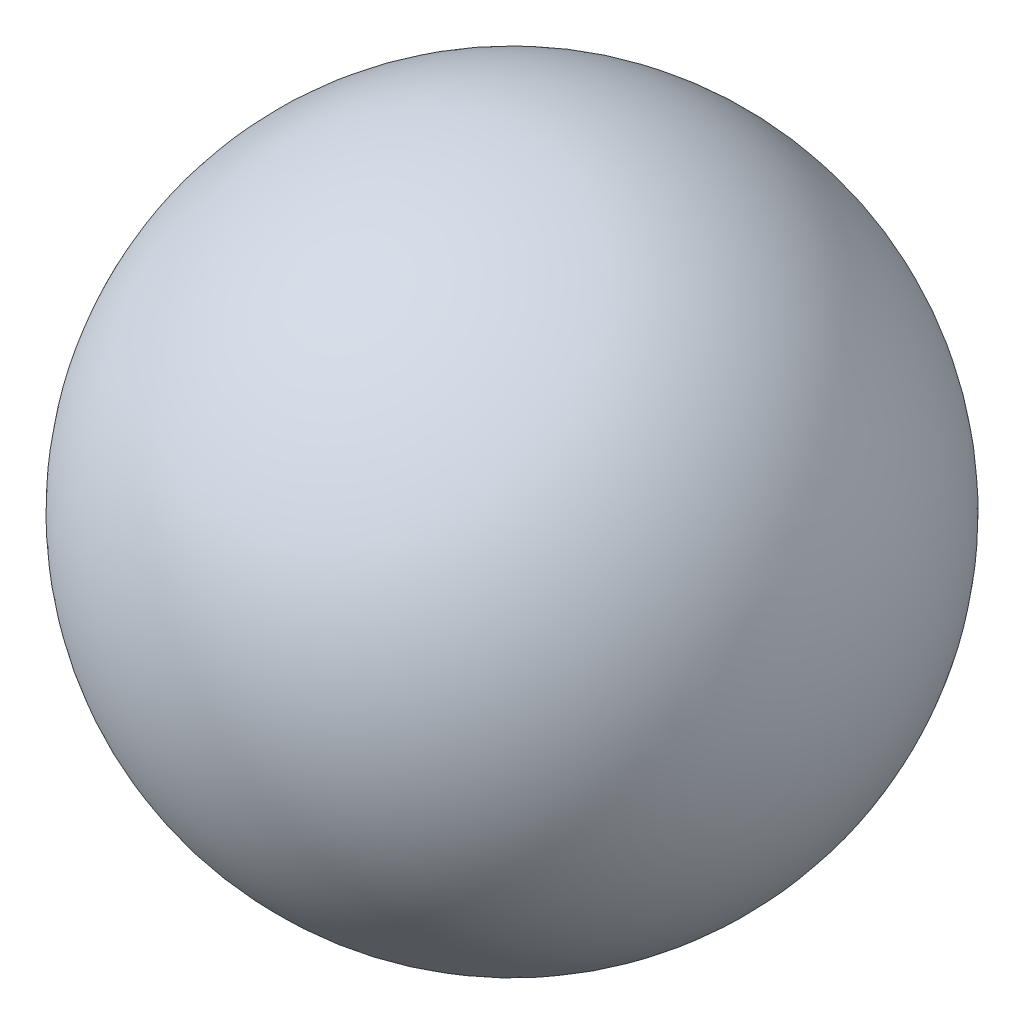
from build123d import *


with BuildPart() as part:
    # Sketch1 → Revolve1 (revolve)
    with BuildSketch(Plane(origin=(0, 0, 0), x_dir=(1, 0, 0), z_dir=(0, 1, 0))):
        with BuildLine():
            Line((43.775, 0), (-43.775, 0))
            ThreePointArc((-43.775, 0), (0, 43.775), (43.775, 0))
        make_face()
    revolve(axis=Axis((-43.775, 0, 0), (1, 0, 0)))


solid = part.part
